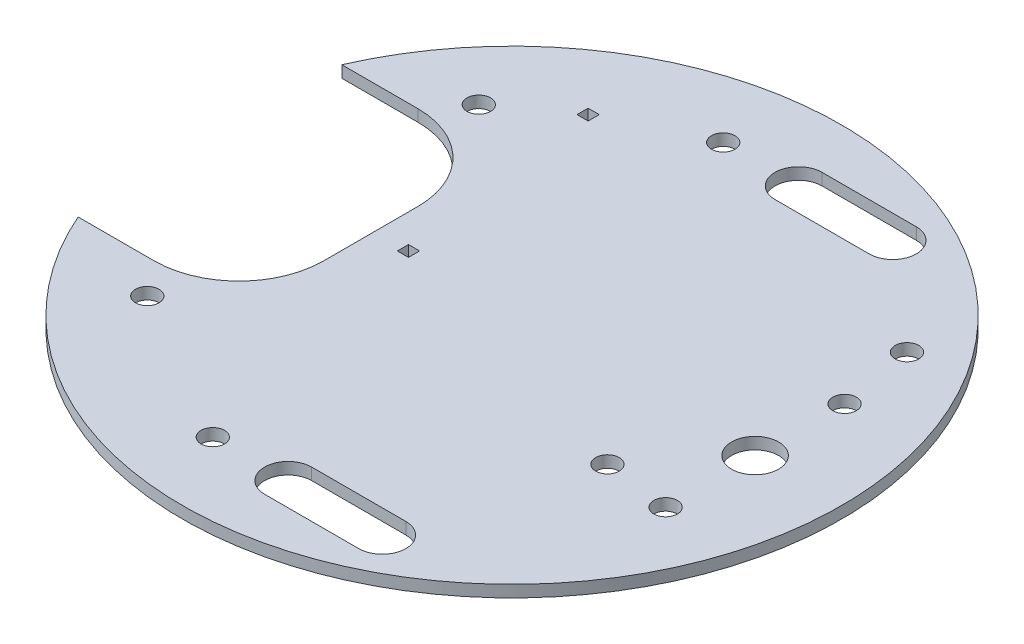
from build123d import *

# Parameters (mm, degrees)
SKETCH2_R           = 88.9
BOSS_EXTRUDE1_DEPTH = 3.175
SKETCH3_R           = 3.175
SKETCH3_W           = 50.8
SKETCH3_H           = 71.12
CUT_EXTRUDE1_DEPTH  = 3.175
SKETCH5_W           = 3
SKETCH5_H           = 3
SKETCH5_R           = 3.175
CUT_EXTRUDE2_DEPTH  = 126.763669734
FILLET1_R           = 22.86
SKETCH6_R           = 6.35
CUT_EXTRUDE3_DEPTH  = 126.763669734


with BuildPart() as part:
    # Sketch2 → Boss-Extrude1 (new body)
    with BuildSketch(Plane(origin=(0, 0, 0), x_dir=(1, 0, 0), z_dir=(0, 1, 0))):
        with Locations(Location((0, 0, 0), (0, 0, 270))):
            Circle(SKETCH2_R)
    extrude(amount=BOSS_EXTRUDE1_DEPTH)

    # Sketch3 → Cut-Extrude1 (cut)
    with BuildSketch(Plane(origin=(0, 3.175, 0), x_dir=(1, 0, 0), z_dir=(0, 1, 0))):
        with Locations(Location((65.549718535, -24.13, 0), (0, 0, 270))):
            Circle(SKETCH3_R)
        with Locations(Location((65.549718535, 24.13, 0), (0, 0, 270))):
            Circle(SKETCH3_R)
        with Locations(Location((-53.672052261, 44.702721462, 0), (0, 0, 270))):
            Circle(SKETCH3_R)
        with Locations(Location((-11.877666274, 68.832721462, 0), (0, 0, 270))):
            Circle(SKETCH3_R)
        with Locations(Location((-11.877666274, -68.832721462, 0), (0, 0, 270))):
            Circle(SKETCH3_R)
        with Locations(Location((-53.672052261, -44.702721462, 0), (0, 0, 270))):
            Circle(SKETCH3_R)
        with Locations((-63.5, 0)):
            Rectangle(SKETCH3_W, SKETCH3_H)
    extrude(amount=-CUT_EXTRUDE1_DEPTH, mode=Mode.SUBTRACT)

    # Sketch5 → Cut-Extrude2 (cut, through all)
    with BuildSketch(Plane(origin=(0, 3.175, 0), x_dir=(1, 0, 0), z_dir=(0, 1, 0))):
        with Locations((-36.6, 57.12)):
            Rectangle(SKETCH5_W, SKETCH5_H)
        with Locations((-28.98, 1.04)):
            Rectangle(SKETCH5_W, SKETCH5_H)
        with Locations(Location((61.9, 44.62, 0), (0, 0, 270))):
            Circle(SKETCH5_R)
        with Locations(Location((47.695, -21.96, 0), (0, 0, 270))):
            Circle(SKETCH5_R)
    extrude(amount=-CUT_EXTRUDE2_DEPTH, mode=Mode.SUBTRACT)

    # Fillet1
    fillet1_edges = [part.edges().sort_by_distance(p)[0] for p in [
        (-38.1, 1.5875, 35.56),
        (-38.1, 1.5875, -35.56),
    ]]
    fillet(fillet1_edges, radius=FILLET1_R)

    # Sketch6 → Cut-Extrude3 (cut, through all)
    with BuildSketch(Plane(origin=(0, 3.175, 0), x_dir=(1, 0, 0), z_dir=(0, 1, 0))):
        with Locations(Location((65.549718535, 0, 0), (0, 0, 270))):
            Circle(SKETCH6_R)
        with BuildLine():
            Line((8.442333726, 75.182721462), (33.842333726, 75.182721462))
            ThreePointArc((33.842333726, 75.182721462), (40.192333726, 68.832721462), (33.842333726, 62.482721462))
            Line((33.842333726, 62.482721462), (8.442333726, 62.482721462))
            ThreePointArc((8.442333726, 62.482721462), (2.092333726, 68.832721462), (8.442333726, 75.182721462))
        make_face()
        with BuildLine():
            Line((8.442333726, -62.482721462), (33.842333726, -62.482721462))
            ThreePointArc((33.842333726, -62.482721462), (40.192333726, -68.832721462), (33.842333726, -75.182721462))
            Line((33.842333726, -75.182721462), (8.442333726, -75.182721462))
            ThreePointArc((8.442333726, -75.182721462), (2.092333726, -68.832721462), (8.442333726, -62.482721462))
        make_face()
    extrude(amount=-CUT_EXTRUDE3_DEPTH, mode=Mode.SUBTRACT)


solid = part.part
